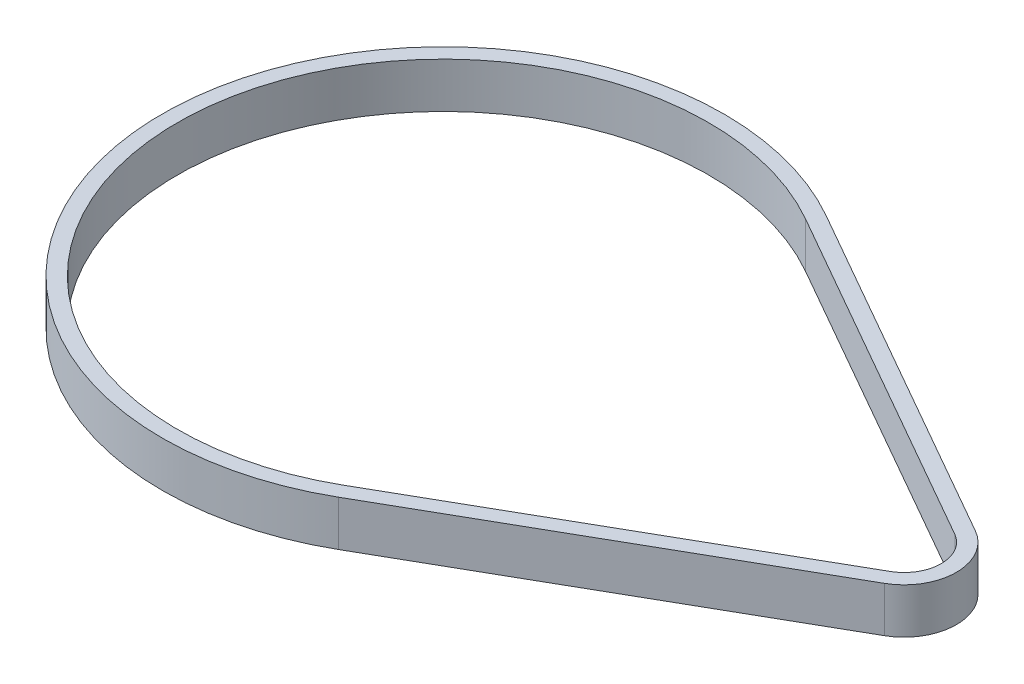
from build123d import *

# Parameters (mm, degrees)
BOSS_EXTRUDE1_DEPTH = 6


with BuildPart() as part:
    # Sketch1 → Boss-Extrude1 (new body)
    with BuildSketch(Plane(origin=(0, 0, 0), x_dir=(1, 0, 0), z_dir=(0, 1, 0))):
        with BuildLine():
            Line((-199.92367576, -32.265483765), (-153.909826989, -6.005809428))
            ThreePointArc((-153.909826989, -6.005809428), (-150.422286416, 0), (-153.909826989, 6.005809428))
            Line((-153.909826989, 6.005809428), (-199.92367576, 32.265483765))
            ThreePointArc((-199.92367576, 32.265483765), (-255.487286416, 0), (-199.92367576, -32.265483765))
        make_face()
        with BuildLine():
            Line((-200.914987235, -30.528445609), (-154.901138465, -4.268771271))
            ThreePointArc((-154.901138465, -4.268771271), (-152.422286416, 0), (-154.901138465, 4.268771271))
            Line((-154.901138465, 4.268771271), (-200.914987235, 30.528445609))
            ThreePointArc((-200.914987235, 30.528445609), (-253.487286416, 0), (-200.914987235, -30.528445609))
        make_face(mode=Mode.SUBTRACT)
    extrude(amount=BOSS_EXTRUDE1_DEPTH)


solid = part.part
